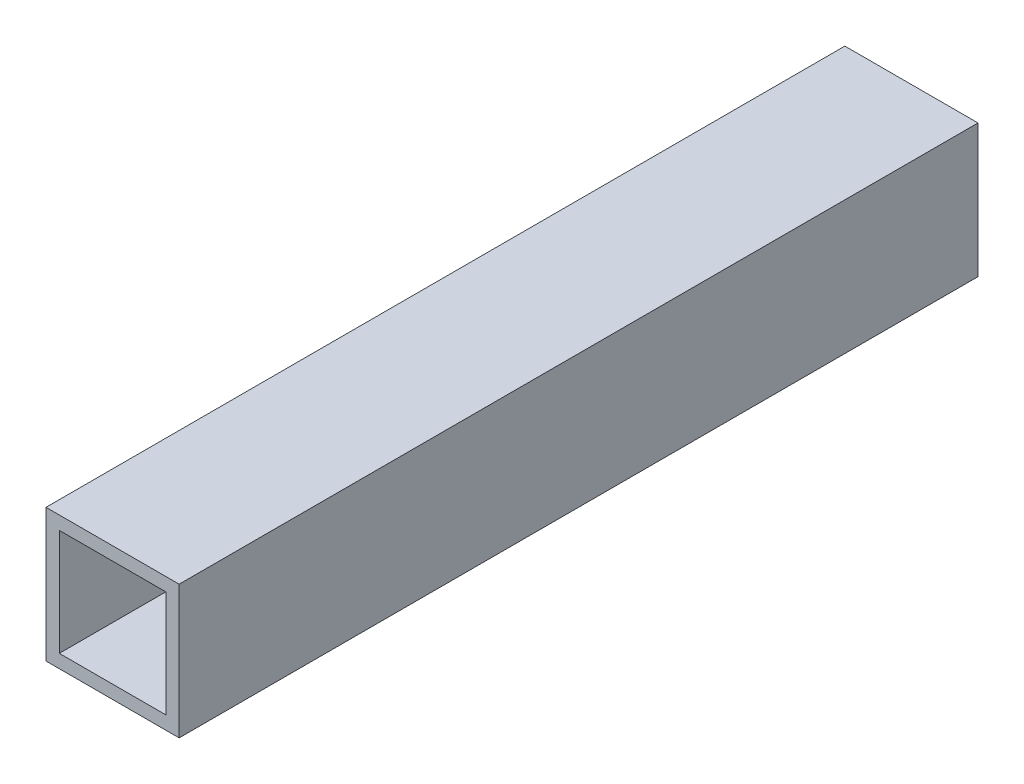
from build123d import *

# Parameters (mm, degrees)
ESQUISSE1_W      = 15
ESQUISSE1_H      = 15
EXTRUSION1_DEPTH = 90
ESQUISSE2_W      = 12
ESQUISSE2_H      = 12
EXTRUSION2_DEPTH = 91.622844802


with BuildPart() as part:
    # Esquisse1 → Extrusion1 (new body)
    with BuildSketch(Plane.XY):
        Rectangle(ESQUISSE1_W, ESQUISSE1_H)
    extrude(amount=EXTRUSION1_DEPTH)

    # Esquisse2 → Extrusion2 (cut, through all)
    with BuildSketch(Plane.XY.offset(90)):
        Rectangle(ESQUISSE2_W, ESQUISSE2_H)
    extrude(amount=-EXTRUSION2_DEPTH, mode=Mode.SUBTRACT)


solid = part.part
